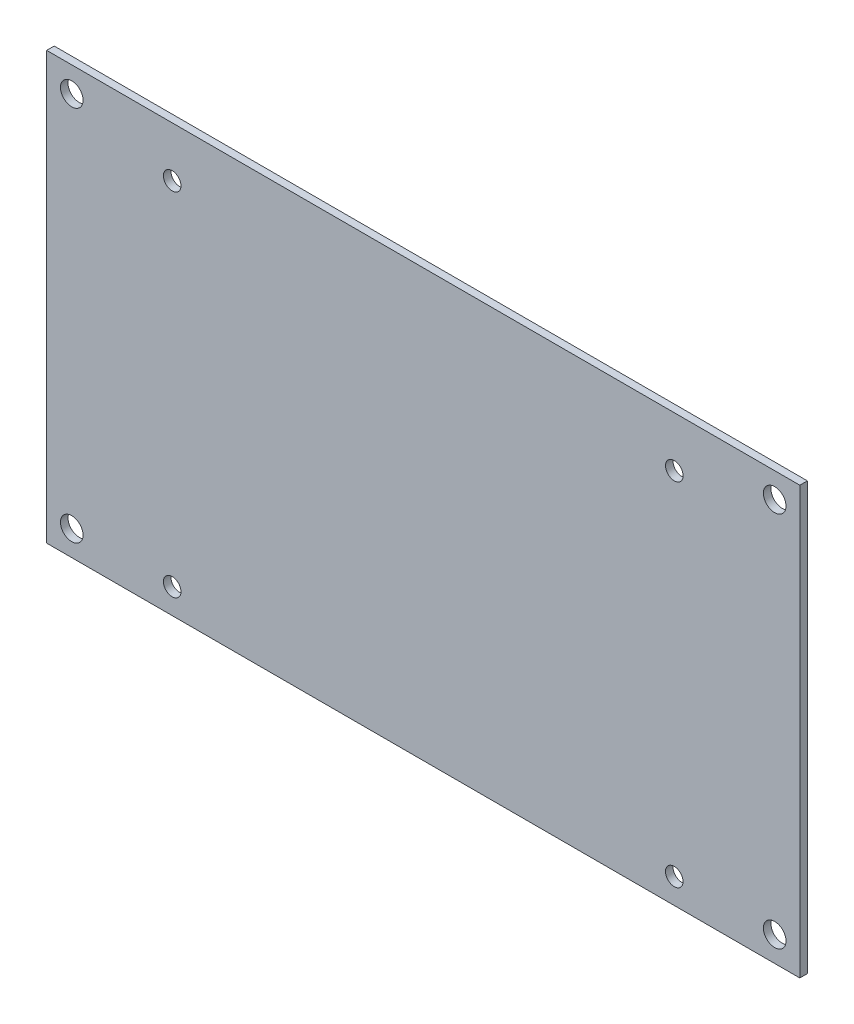
from build123d import *

# Parameters (mm, degrees)
SKETCH_1_W      = 150
SKETCH_1_H      = 85
SKETCH_1_R      = 2.25
SKETCH_1_R_2    = 1.75
EXTRUDE_1_DEPTH = 1.5


with BuildPart() as part:
    # Эскиз1 → Вытянуть1 (new body)
    with BuildSketch(Plane.XY):
        Rectangle(SKETCH_1_W, SKETCH_1_H)
        with Locations((-70, 37.5)):
            Circle(SKETCH_1_R, mode=Mode.SUBTRACT)
        with Locations(Location((-70, -37.5, 0), (0, 0, 180))):
            Circle(SKETCH_1_R, mode=Mode.SUBTRACT)
        with Locations((70, -37.5)):
            Circle(SKETCH_1_R, mode=Mode.SUBTRACT)
        with Locations(Location((70, 37.5, 0), (0, 0, 180))):
            Circle(SKETCH_1_R, mode=Mode.SUBTRACT)
        with Locations((-50, 32.5)):
            Circle(SKETCH_1_R_2, mode=Mode.SUBTRACT)
        with Locations(Location((-50, -37.5, 0), (0, 0, 180))):
            Circle(SKETCH_1_R_2, mode=Mode.SUBTRACT)
        with Locations((50, 32.5)):
            Circle(SKETCH_1_R_2, mode=Mode.SUBTRACT)
        with Locations(Location((50, -37.5, 0), (0, 0, 180))):
            Circle(SKETCH_1_R_2, mode=Mode.SUBTRACT)
    extrude(amount=EXTRUDE_1_DEPTH)


solid = part.part
